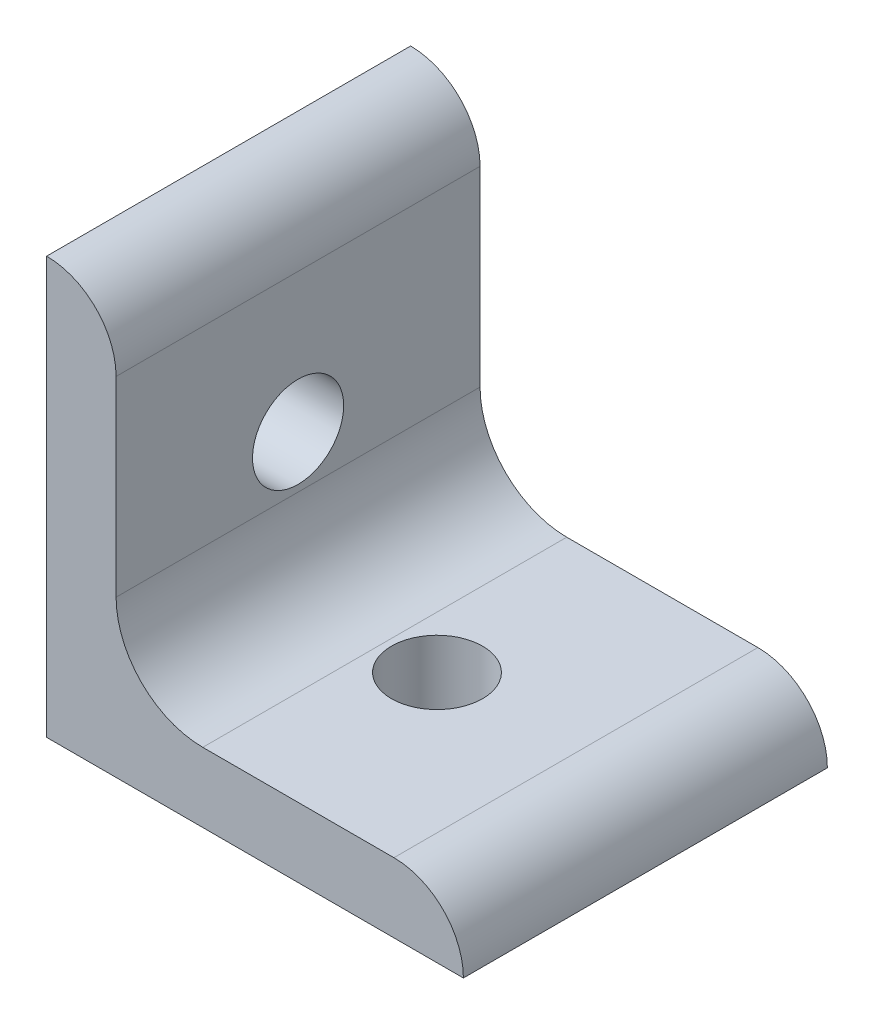
from build123d import *

# Parameters (mm, degrees)
BOSS_EXTRUDE1_DEPTH      = 16.637
BOSS_EXTRUDE1_DEPTH_BACK = 16.637
CUT_EXTRUDE1_DEPTH       = 32.663776923
CUT_EXTRUDE1_DEPTH_BACK  = 32.663776923
SKETCH4_R                = 4.1656
CUT_EXTRUDE2_DEPTH       = 32.663776923
CUT_EXTRUDE2_DEPTH_BACK  = 32.663776923
SKETCH5_R                = 4.1656


with BuildPart() as part:
    # Sketch3 → Boss-Extrude1 (new, two sides: drawn at the far end of the back side and taken through both)
    with BuildSketch(Plane.XY.offset(-BOSS_EXTRUDE1_DEPTH_BACK)):
        with BuildLine():
            Line((-19.05, 19.05), (-19.05, -19.05))
            Line((-19.05, -19.05), (19.05, -19.05))
            ThreePointArc((19.05, -19.05), (17.190128061, -14.559871939), (12.7, -12.7))
            Line((12.7, -12.7), (-4.7752, -12.7))
            ThreePointArc((-4.7752, -12.7), (-10.37887982, -10.37887982), (-12.7, -4.7752))
            Line((-12.7, -4.7752), (-12.7, 12.7))
            ThreePointArc((-12.7, 12.7), (-14.559871939, 17.190128061), (-19.05, 19.05))
        make_face()
    extrude(amount=BOSS_EXTRUDE1_DEPTH + BOSS_EXTRUDE1_DEPTH_BACK)

    # Sketch4 → Cut-Extrude1 (cut, two sides: drawn at the far end of the back side and taken through both)
    with BuildSketch(Plane(origin=(0, 0, 0), x_dir=(1, 0, 0), z_dir=(0, 1, 0)).offset(-CUT_EXTRUDE1_DEPTH_BACK)):
        with Locations(Location((0, 0, 0), (0, 0, 270))):
            Circle(SKETCH4_R)
    extrude(amount=CUT_EXTRUDE1_DEPTH + CUT_EXTRUDE1_DEPTH_BACK, mode=Mode.SUBTRACT)

    # Sketch5 → Cut-Extrude2 (cut, two sides: drawn at the far end of the back side and taken through both)
    with BuildSketch(Plane(origin=(0, 0, 0), x_dir=(0, 0, -1), z_dir=(1, 0, 0)).offset(-CUT_EXTRUDE2_DEPTH_BACK)):
        Circle(SKETCH5_R)
    extrude(amount=CUT_EXTRUDE2_DEPTH + CUT_EXTRUDE2_DEPTH_BACK, mode=Mode.SUBTRACT)


solid = part.part
